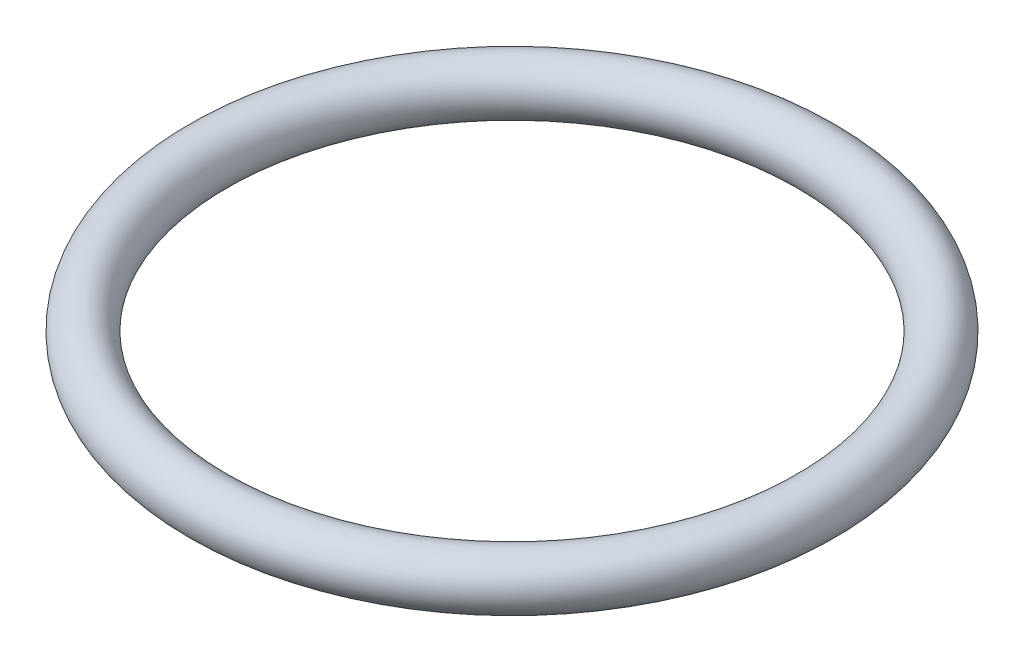
from build123d import *

# Parameters (mm, degrees)
ESQUISSE1_R = 2.5


with BuildPart() as part:
    # Esquisse1 → Révolution1 (revolve)
    with BuildSketch(Plane.XY, mode=Mode.PRIVATE) as r_volution1_sk:
        with Locations((29, 0)):
            Circle(ESQUISSE1_R)
    revolve(r_volution1_sk.sketch.rotate(Axis((0, 0, 0), (0, 1, 0)), 90), axis=Axis((0, 0, 0), (0, 1, 0)))


solid = part.part
